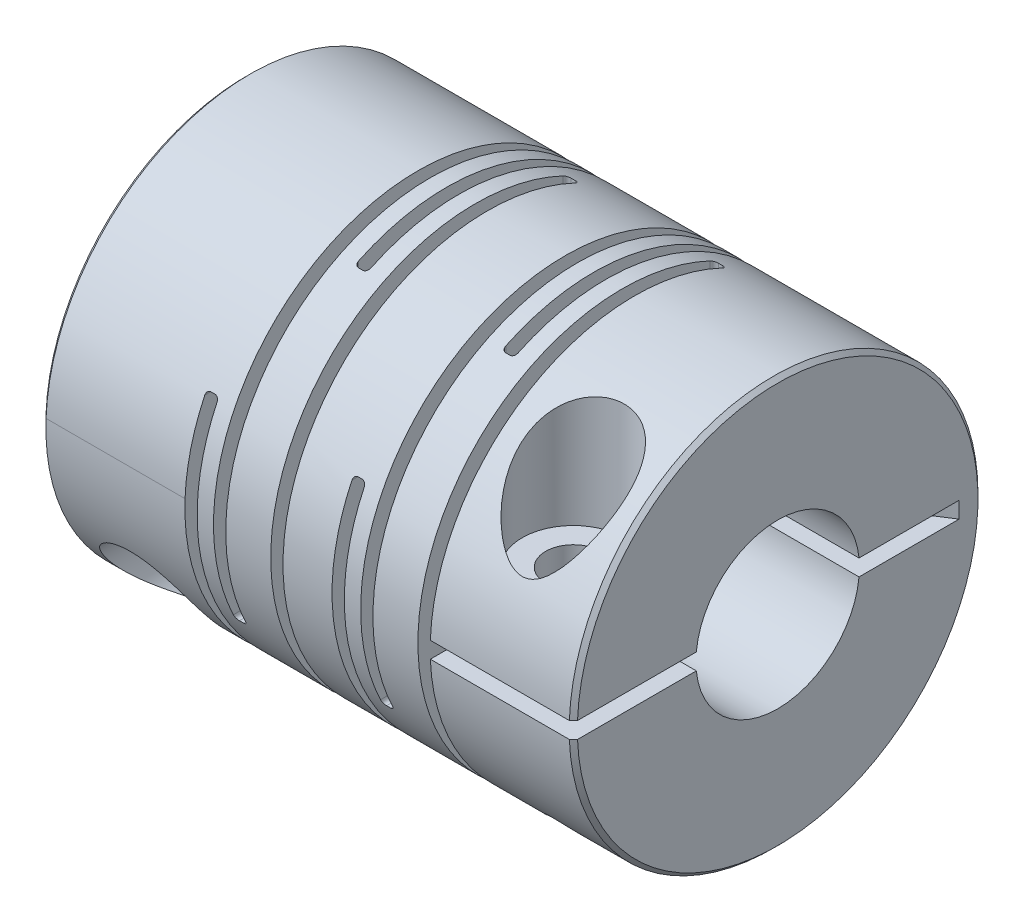
from build123d import *

# Parameters (mm, degrees)
SKETCH1_W                          = 26
SKETCH1_H                          = 10
CUT_EXTRUDE1_DEPTH                 = 35.292856399
CUT_EXTRUDE2_DEPTH                 = 35.292856562
CHAMFER1_SIZE                      = 0.2
CUT_EXTRUDE3_DEPTH                 = 0.4
CUT_EXTRUDE4_DEPTH                 = 0.4
SOCKET_HEAD_CAP_SCREW1_D           = 2.7
SOCKET_HEAD_CAP_SCREW1_DEPTH       = 9.6
SOCKET_HEAD_CAP_SCREW1_CBORE_D     = 5
SOCKET_HEAD_CAP_SCREW1_CBORE_DEPTH = 6.5
TAP1_D                             = 2.013
SOCKET_HEAD_CAP_SCREW2_D           = 2.7
SOCKET_HEAD_CAP_SCREW2_DEPTH       = 9.6
SOCKET_HEAD_CAP_SCREW2_CBORE_D     = 5
SOCKET_HEAD_CAP_SCREW2_CBORE_DEPTH = 6.5
TAP2_D                             = 2.013
SKETCH16_W                         = 12
SKETCH16_H                         = 4
SKETCH17_R                         = 3
CUT_EXTRUDE5_DEPTH                 = 7
CUT_EXTRUDE6_START                 = -7
SKETCH18_R                         = 4
CUT_EXTRUDE6_DEPTH                 = 7


with BuildPart() as part:
    # Sketch1 → Revolve1 (revolve)
    with BuildSketch(Plane.XY, mode=Mode.PRIVATE) as revolve1_sk:
        with Locations((13, 5)):
            Rectangle(SKETCH1_W, SKETCH1_H)
    revolve(revolve1_sk.sketch.rotate(Axis((0, 0, 0), (1, 0, 0)), 90), axis=Axis((0, 0, 0), (1, 0, 0)))

    # Sketch2 → Cut-Extrude1 (cut, through all)
    with BuildSketch(Plane.XY.offset(10)):
        with BuildLine():
            Line((16.2, 10), (16.2, -4.3))
            ThreePointArc((16.2, -4.3), (16.141421356, -4.441421356), (16, -4.5))
            Line((16, -4.5), (15.8, -4.5))
            ThreePointArc((15.8, -4.5), (15.658578644, -4.441421356), (15.6, -4.3))
            Line((15.6, -4.3), (15.6, 10))
            Line((15.6, 10), (16.2, 10))
        make_face()
        with BuildLine():
            Line((14.8, 4.3), (14.8, -10))
            Line((14.8, -10), (14.2, -10))
            Line((14.2, -10), (14.2, 4.3))
            ThreePointArc((14.2, 4.3), (14.258578644, 4.441421356), (14.4, 4.5))
            Line((14.4, 4.5), (14.6, 4.5))
            ThreePointArc((14.6, 4.5), (14.741421356, 4.441421356), (14.8, 4.3))
        make_face()
        with BuildLine():
            Line((9, 10), (9, -4.3))
            ThreePointArc((9, -4.3), (8.941421356, -4.441421356), (8.8, -4.5))
            Line((8.8, -4.5), (8.6, -4.5))
            ThreePointArc((8.6, -4.5), (8.458578644, -4.441421356), (8.4, -4.3))
            Line((8.4, -4.3), (8.4, 10))
            Line((8.4, 10), (9, 10))
        make_face()
        with BuildLine():
            Line((7.6, 4.3), (7.6, -10))
            Line((7.6, -10), (7, -10))
            Line((7, -10), (7, 4.3))
            ThreePointArc((7, 4.3), (7.058578644, 4.441421356), (7.2, 4.5))
            Line((7.2, 4.5), (7.4, 4.5))
            ThreePointArc((7.4, 4.5), (7.541421356, 4.441421356), (7.6, 4.3))
        make_face()
    extrude(amount=-CUT_EXTRUDE1_DEPTH, mode=Mode.SUBTRACT)

    # Sketch3 → Cut-Extrude2 (cut, through all)
    with BuildSketch(Plane(origin=(0, 10, 0), x_dir=(1, 0, 0), z_dir=(0, 1, 0))):
        with BuildLine():
            Line((17.6, 10), (17.6, -4.3))
            ThreePointArc((17.6, -4.3), (17.541421356, -4.441421356), (17.4, -4.5))
            Line((17.4, -4.5), (17.2, -4.5))
            ThreePointArc((17.2, -4.5), (17.058578644, -4.441421356), (17, -4.3))
            Line((17, -4.3), (17, 10))
            Line((17, 10), (17.6, 10))
        make_face()
        with BuildLine():
            Line((19, 4.3), (19, -10))
            Line((19, -10), (18.4, -10))
            Line((18.4, -10), (18.4, 4.3))
            ThreePointArc((18.4, 4.3), (18.458578644, 4.441421356), (18.6, 4.5))
            Line((18.6, 4.5), (18.8, 4.5))
            ThreePointArc((18.8, 4.5), (18.941421356, 4.441421356), (19, 4.3))
        make_face()
        with BuildLine():
            Line((10.4, 10), (10.4, -4.3))
            ThreePointArc((10.4, -4.3), (10.341421356, -4.441421356), (10.2, -4.5))
            Line((10.2, -4.5), (10, -4.5))
            ThreePointArc((10, -4.5), (9.858578644, -4.441421356), (9.8, -4.3))
            Line((9.8, -4.3), (9.8, 10))
            Line((9.8, 10), (10.4, 10))
        make_face()
        with BuildLine():
            Line((11.8, 4.3), (11.8, -10))
            Line((11.8, -10), (11.2, -10))
            Line((11.2, -10), (11.2, 4.3))
            ThreePointArc((11.2, 4.3), (11.258578644, 4.441421356), (11.4, 4.5))
            Line((11.4, 4.5), (11.6, 4.5))
            ThreePointArc((11.6, 4.5), (11.741421356, 4.441421356), (11.8, 4.3))
        make_face()
    extrude(amount=-CUT_EXTRUDE2_DEPTH, mode=Mode.SUBTRACT)

    # Chamfer1
    chamfer1_edges = [part.edges().sort_by_distance(p)[0] for p in [
        (26, 0, -10),
        (0, 0, -10),
    ]]
    chamfer(chamfer1_edges, length=CHAMFER1_SIZE)

    # Sketch4 → Cut-Extrude3 (cut, symmetric)
    with BuildSketch(Plane.XY):
        with BuildLine():
            Line((7.3, -10), (-7.7, -10))
            Line((-7.7, -10), (-7.7, 11))
            ThreePointArc((-7.7, 11), (2.906601718, 6.606601718), (7.3, -4))
            Line((7.3, -4), (7.3, -10))
        make_face()
    extrude(amount=CUT_EXTRUDE3_DEPTH, both=True, mode=Mode.SUBTRACT)

    # Sketch5 → Cut-Extrude4 (cut, symmetric)
    with BuildSketch(Plane(origin=(0, 0, 0), x_dir=(1, 0, 0), z_dir=(0, 1, 0))):
        with BuildLine():
            Line((18.7, -10), (33.7, -10))
            Line((33.7, -10), (33.7, 11))
            ThreePointArc((33.7, 11), (23.093398282, 6.606601718), (18.7, -4))
            Line((18.7, -4), (18.7, -10))
        make_face()
    extrude(amount=CUT_EXTRUDE4_DEPTH, both=True, mode=Mode.SUBTRACT)

    # Socket Head Cap Screw1
    with Locations(Plane.XY.offset(10)):
        with Locations((3.5, -6.5)):
            CounterBoreHole(SOCKET_HEAD_CAP_SCREW1_D / 2, SOCKET_HEAD_CAP_SCREW1_CBORE_D / 2, SOCKET_HEAD_CAP_SCREW1_CBORE_DEPTH, depth=SOCKET_HEAD_CAP_SCREW1_DEPTH)

    # Tap1 (through all)
    with Locations(Plane.XY.offset(-0.4)):
        with Locations((3.5, -6.5)):
            Hole(TAP1_D / 2)

    # Socket Head Cap Screw2
    with Locations(Plane(origin=(0, 10, 0), x_dir=(1, 0, 0), z_dir=(0, 1, 0))):
        with Locations((22.5, -6.5)):
            CounterBoreHole(SOCKET_HEAD_CAP_SCREW2_D / 2, SOCKET_HEAD_CAP_SCREW2_CBORE_D / 2, SOCKET_HEAD_CAP_SCREW2_CBORE_DEPTH, depth=SOCKET_HEAD_CAP_SCREW2_DEPTH)

    # Tap2 (through all)
    with Locations(Plane(origin=(0, -0.4, 0), x_dir=(1, 0, 0), z_dir=(0, 1, 0))):
        with Locations((22.5, -6.5)):
            Hole(TAP2_D / 2)

    # Sketch16 → Cut-Revolve2 (revolve, cut)
    with BuildSketch(Plane.XY, mode=Mode.PRIVATE) as cut_revolve2_sk:
        with Locations((13, 2.004083334)):
            Rectangle(SKETCH16_W, SKETCH16_H)
    revolve(cut_revolve2_sk.sketch.rotate(Axis((0, 0.004083334, 0), (1, 0, 0)), 90), axis=Axis((0, 0.004083334, 0), (1, 0, 0)), mode=Mode.SUBTRACT)

    # Sketch17 → Cut-Extrude5 (cut)
    with BuildSketch(Plane(origin=(0, 0, 0), x_dir=(0, 0, -1), z_dir=(1, 0, 0))):
        Circle(SKETCH17_R)
    extrude(amount=CUT_EXTRUDE5_DEPTH, mode=Mode.SUBTRACT)

    # Sketch18 → Cut-Extrude6 (cut)
    with BuildSketch(Plane(origin=(26, 0, 0), x_dir=(0, 0, -1), z_dir=(1, 0, 0)).offset(CUT_EXTRUDE6_START)):
        Circle(SKETCH18_R)
    extrude(amount=CUT_EXTRUDE6_DEPTH, mode=Mode.SUBTRACT)


solid = part.part
